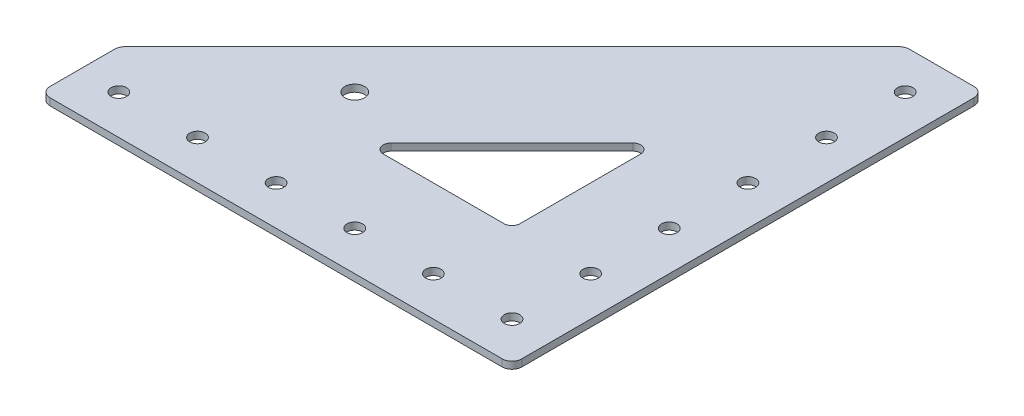
from build123d import *

# Parameters (mm, degrees)
SKETCH1_R           = 2.4892
SKETCH1_R_2         = 3.175
BOSS_EXTRUDE2_DEPTH = 1.143
FILLET1_R           = 3.175
FILLET2_R           = 3.175
SKETCH2_OUTSIDE_W   = 197.508
SKETCH2_OUTSIDE_H   = 197.508
SKETCH2_OUTSIDE_W_2 = 152.4
SKETCH2_OUTSIDE_H_2 = 152.4
CUT_EXTRUDE1_DEPTH  = 2.54
FILLET3_R           = 2.54


with BuildPart() as part:
    # Sketch1 → Boss-Extrude2 (new, symmetric)
    with BuildSketch(Plane(origin=(0, 0, 0), x_dir=(1, 0, 0), z_dir=(0, 1, 0))):
        Polygon((0, 0), (0, 152.4), (-25.4, 152.4), (-152.4, 25.4), (-152.4, 0), align=None)
        with Locations(Location((-12.7, 12.7, 0), (0, 0, 270))):
            Circle(SKETCH1_R, mode=Mode.SUBTRACT)
        with Locations(Location((-38.1, 12.7, 0), (0, 0, 270))):
            Circle(SKETCH1_R, mode=Mode.SUBTRACT)
        with Locations(Location((-63.5, 12.7, 0), (0, 0, 270))):
            Circle(SKETCH1_R, mode=Mode.SUBTRACT)
        with Locations(Location((-88.9, 12.7, 0), (0, 0, 270))):
            Circle(SKETCH1_R, mode=Mode.SUBTRACT)
        with Locations(Location((-114.3, 12.7, 0), (0, 0, 270))):
            Circle(SKETCH1_R, mode=Mode.SUBTRACT)
        with Locations(Location((-12.7, 38.1, 0), (0, 0, 270))):
            Circle(SKETCH1_R, mode=Mode.SUBTRACT)
        with Locations(Location((-12.7, 63.5, 0), (0, 0, 270))):
            Circle(SKETCH1_R, mode=Mode.SUBTRACT)
        with Locations(Location((-12.7, 88.9, 0), (0, 0, 270))):
            Circle(SKETCH1_R, mode=Mode.SUBTRACT)
        with Locations(Location((-12.7, 114.3, 0), (0, 0, 270))):
            Circle(SKETCH1_R, mode=Mode.SUBTRACT)
        with Locations(Location((-139.7, 12.7, 0), (0, 0, 270))):
            Circle(SKETCH1_R, mode=Mode.SUBTRACT)
        with Locations(Location((-12.7, 139.7, 0), (0, 0, 270))):
            Circle(SKETCH1_R, mode=Mode.SUBTRACT)
        with Locations(Location((-101.6, 50.8, 0), (0, 0, 270))):
            Circle(SKETCH1_R_2, mode=Mode.SUBTRACT)
    extrude(amount=BOSS_EXTRUDE2_DEPTH, both=True)

    # Fillet1
    fillet1_edges = [part.edges().sort_by_distance(p)[0] for p in [
        (-152.4, 0, 0),
        (0, 0, 0),
    ]]
    fillet(fillet1_edges, radius=FILLET1_R)

    # Fillet2
    fillet2_edges = [part.edges().sort_by_distance(p)[0] for p in [
        (-152.4, 0, -25.4),
        (-25.4, 0, -152.4),
        (0, 0, -152.4),
    ]]
    fillet(fillet2_edges, radius=FILLET2_R)

    # Sketch2 outside → Cut-Extrude1 (cut)
    # profile 1 of 2: a face of its own
    with BuildSketch(Plane(origin=(0, 1.143, 0), x_dir=(1, 0, 0), z_dir=(0, 1, 0))):
        with Locations((-76.2, 76.2)):
            Rectangle(SKETCH2_OUTSIDE_W, SKETCH2_OUTSIDE_H)
        with Locations((-76.2, 76.2)):
            Rectangle(SKETCH2_OUTSIDE_W_2, SKETCH2_OUTSIDE_H_2, mode=Mode.SUBTRACT)
    # profile 2 of 2: a face of its own
    with BuildSketch(Plane(origin=(0, 1.143, 0), x_dir=(1, 0, 0), z_dir=(0, 1, 0))):
        Polygon((-38.1, 85.818463274), (-85.818463274, 38.1), (-38.1, 38.1), align=None)
    extrude(amount=-CUT_EXTRUDE1_DEPTH, mode=Mode.SUBTRACT)

    # Fillet3
    fillet3_edges = [part.edges().sort_by_distance(p)[0] for p in [
        (-38.1, 0, -85.818463274),
        (-38.1, 0, -38.1),
        (-85.818463274, 0, -38.1),
    ]]
    fillet(fillet3_edges, radius=FILLET3_R)


solid = part.part
